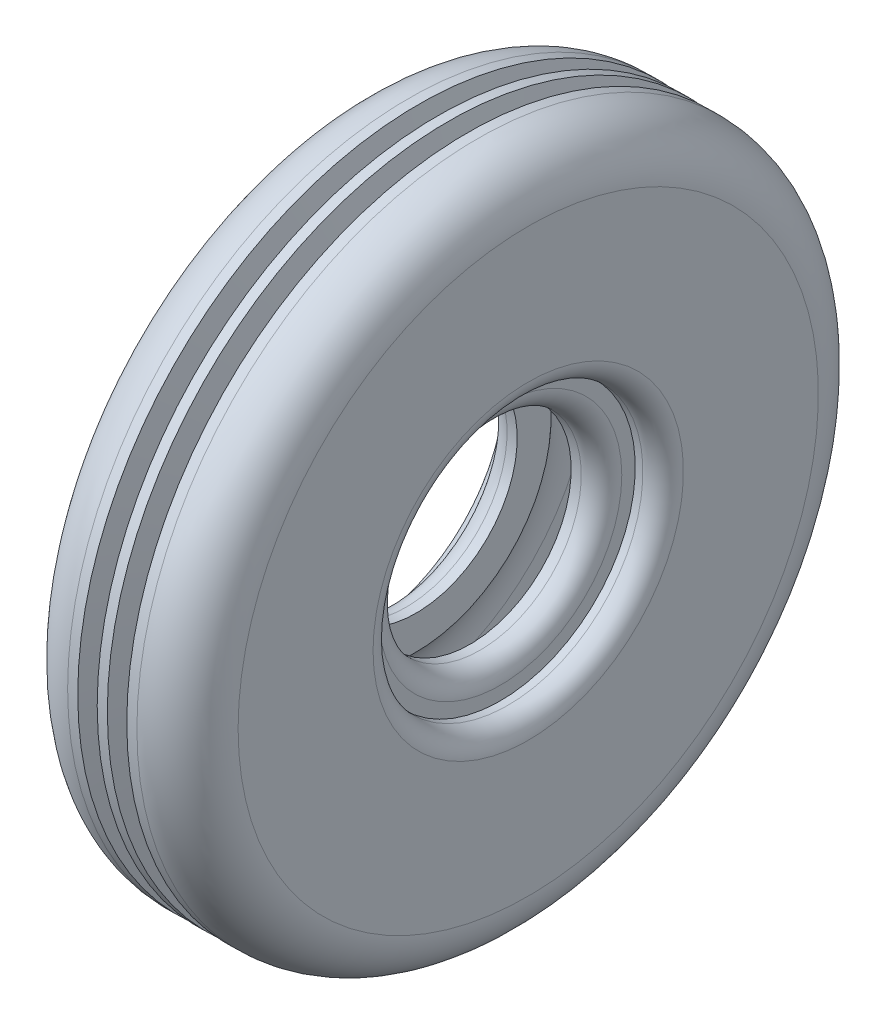
from build123d import *


with BuildPart() as part:
    # Esquisse1 → Révolution1 (revolve)
    with BuildSketch(Plane.XY, mode=Mode.PRIVATE) as r_volution1_sk:
        with BuildLine():
            Line((241.893601797, 300), (241.893601797, 430))
            ThreePointArc((241.893601797, 430), (219.926610386, 483.033008589), (166.893601797, 505))
            Line((166.893601797, 505), (151.893601797, 505))
            Line((151.893601797, 505), (142.479795291, 466.123525789))
            Line((142.479795291, 466.123525789), (132.479795291, 466.123525789))
            Line((132.479795291, 466.123525789), (123.065988785, 505))
            Line((123.065988785, 505), (108.065988785, 505))
            Line((108.065988785, 505), (98.65218228, 466.123525789))
            Line((98.65218228, 466.123525789), (88.65218228, 466.123525789))
            Line((88.65218228, 466.123525789), (79.238375774, 505))
            Line((79.238375774, 505), (64.238375774, 505))
            ThreePointArc((64.238375774, 505), (11.205367185, 483.033008589), (-10.761624226, 430))
            Line((-10.761624226, 430), (-10.761624226, 300))
            Line((-10.761624226, 300), (-10.761624226, 230))
            ThreePointArc((-10.761624226, 230), (-1.974827662, 208.786796564), (19.238375774, 200))
            Line((19.238375774, 200), (30.565988785, 200))
            Line((30.565988785, 200), (30.565988785, 180))
            ThreePointArc((30.565988785, 180), (39.35278535, 158.786796564), (60.565988785, 150))
            Line((60.565988785, 150), (75.565988785, 150))
            Line((75.565988785, 150), (75.565988785, 200))
            ThreePointArc((75.565988785, 200), (44.977364327, 245.898309645), (34.238375774, 300))
            Line((34.238375774, 300), (34.238375774, 400))
            ThreePointArc((34.238375774, 400), (43.025172338, 421.213203436), (64.238375774, 430))
            Line((64.238375774, 430), (166.893601797, 430))
            ThreePointArc((166.893601797, 430), (188.106805232, 421.213203436), (196.893601797, 400))
            Line((196.893601797, 400), (196.893601797, 300))
            ThreePointArc((196.893601797, 300), (186.154613243, 245.898309645), (155.565988785, 200))
            Line((155.565988785, 200), (155.565988785, 150))
            Line((155.565988785, 150), (170.565988785, 150))
            ThreePointArc((170.565988785, 150), (191.779192221, 158.786796564), (200.565988785, 180))
            Line((200.565988785, 180), (200.565988785, 200))
            Line((200.565988785, 200), (211.893601797, 200))
            ThreePointArc((211.893601797, 200), (233.106805232, 208.786796564), (241.893601797, 230))
            Line((241.893601797, 230), (241.893601797, 300))
        make_face()
    revolve(r_volution1_sk.sketch.rotate(Axis((0, 0, 0), (1, 0, 0)), 90), axis=Axis((0, 0, 0), (1, 0, 0)))


solid = part.part
